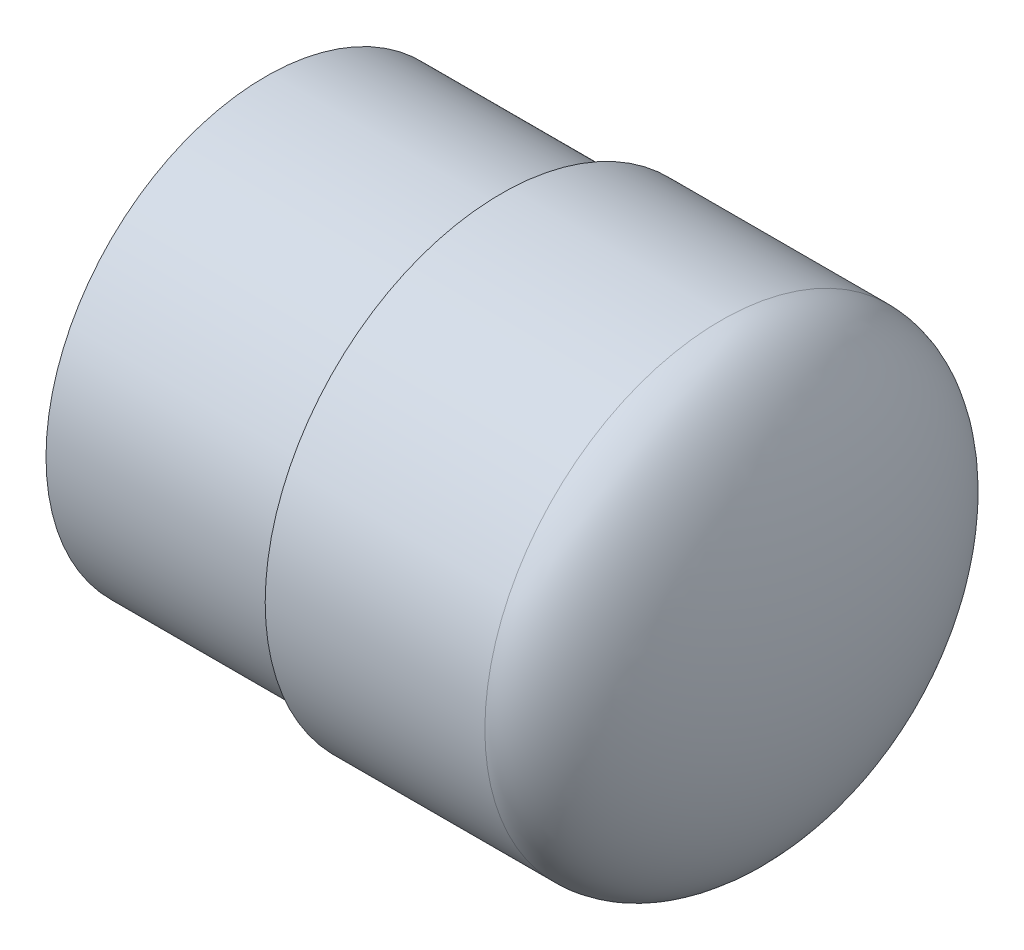
from build123d import *


with BuildPart() as part:
    # Sketch1 → Revolve1 (revolve)
    with BuildSketch(Plane.XY, mode=Mode.PRIVATE) as revolve1_sk:
        with BuildLine():
            Line((-138.90625, -109.5375), (-21.43125, -109.5375))
            Line((-21.43125, -109.5375), (-21.43125, -117.7163))
            Line((-21.43125, -117.7163), (88.10625, -117.7163))
            add(Edge.make_bspline(
                [(88.10625, -117.7163), (138.90625, -117.7163), (138.90625, 0)],
                knots=[3.141592654, 3.141592654, 3.141592654, 4.71238898, 4.71238898, 4.71238898], degree=2, weights=[1, 0.707106781, 1]))
            Line((138.90625, 0), (130.72745, 0))
            add(Edge.make_bspline(
                [(88.10625, -101.3587), (130.72745, -101.3587), (130.72745, 0)],
                knots=[0, 0, 0, 1.570796327, 1.570796327, 1.570796327], degree=2, weights=[1, 0.707106781, 1]))
            Line((88.10625, -101.3587), (-138.90625, -101.3587))
            Line((-138.90625, -101.3587), (-138.90625, -109.5375))
        make_face()
    revolve(revolve1_sk.sketch.rotate(Axis((-138.90625, 0, 0), (1, 0, 0)), 270), axis=Axis((-138.90625, 0, 0), (1, 0, 0)))


solid = part.part
